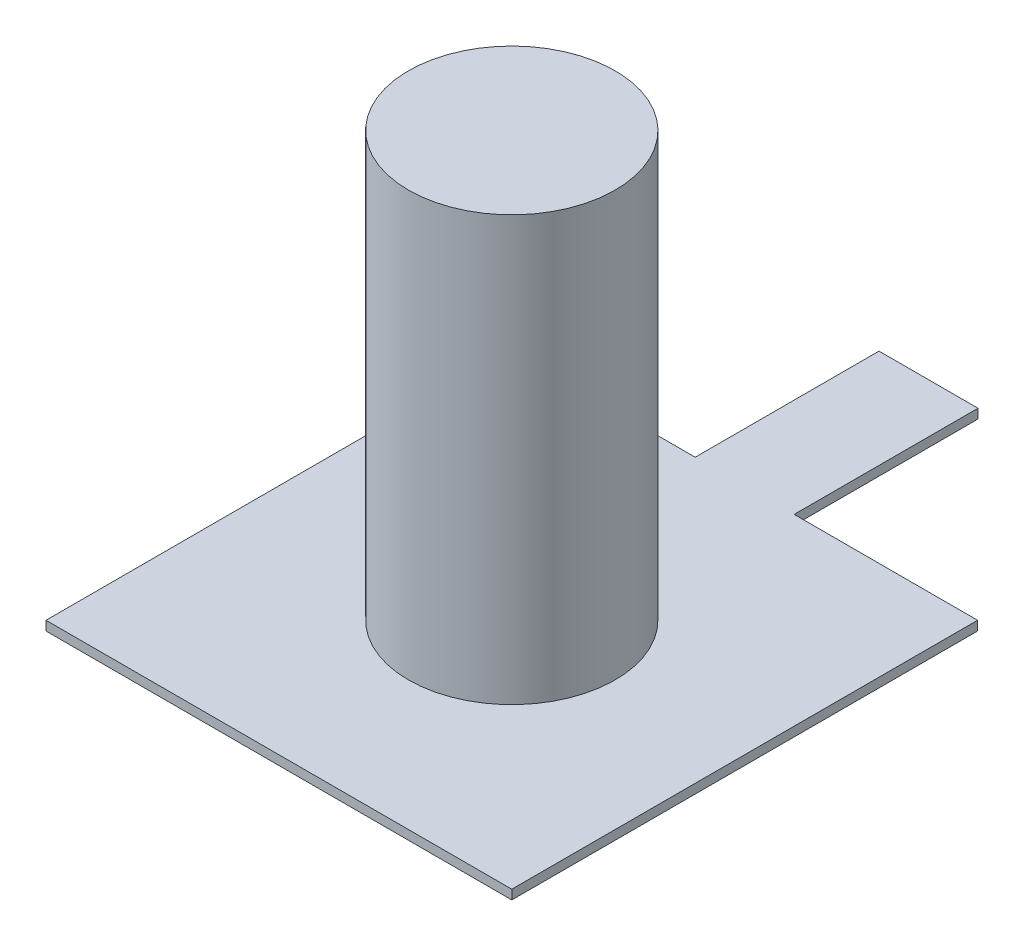
from build123d import *

# Parameters (mm, degrees)
BOSS_EXTRUDE1_DEPTH = 0.33
SKETCH2_R           = 3.655
BOSS_EXTRUDE2_DEPTH = 15


with BuildPart() as part:
    # Sketch1 → Boss-Extrude1 (new body)
    with BuildSketch(Plane(origin=(0, 0, 0), x_dir=(1, 0, 0), z_dir=(0, 1, 0))):
        Polygon((0, 0), (16.47, 0), (16.47, 16.47), (9.985, 16.47), (9.985, 22.97), (6.485, 22.97), (6.485, 16.47), (0, 16.47), align=None)
    extrude(amount=BOSS_EXTRUDE1_DEPTH)

    # Sketch2 → Boss-Extrude2 (add)
    with BuildSketch(Plane(origin=(0, 0.33, 0), x_dir=(1, 0, 0), z_dir=(0, 1, 0))):
        with Locations(Location((8.235, 8.235, 0), (0, 0, 270))):
            Circle(SKETCH2_R)
    extrude(amount=BOSS_EXTRUDE2_DEPTH)


solid = part.part
